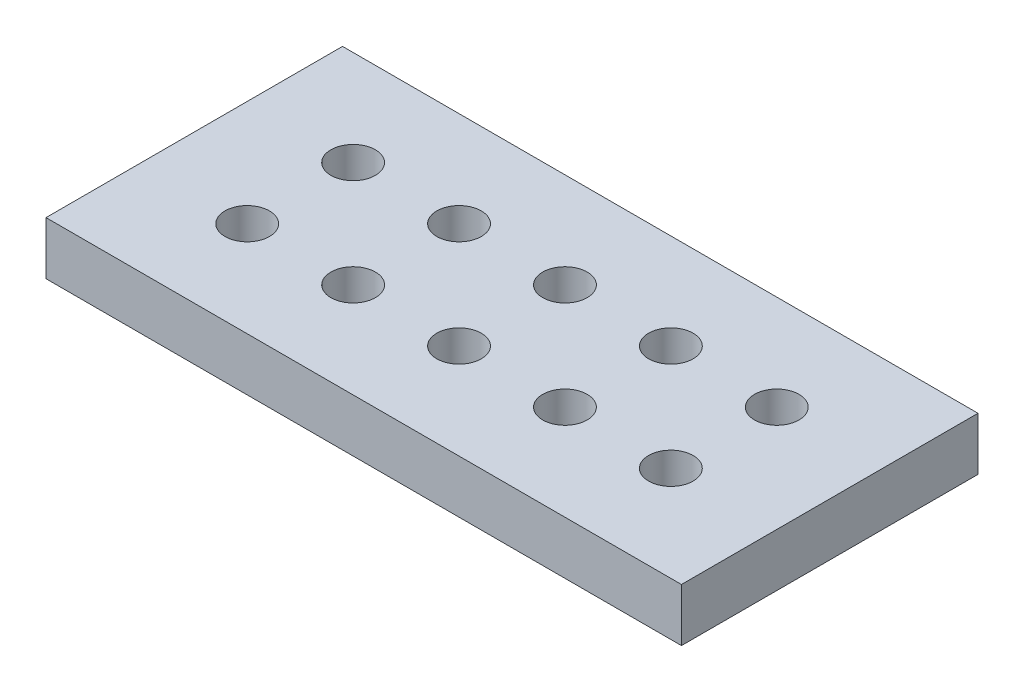
from build123d import *

# Parameters (mm, degrees)
SKETCH1_W           = 76.2
SKETCH1_H           = 35.56
SKETCH1_R           = 2.667
BOSS_EXTRUDE1_DEPTH = 3.175
SKETCH2_R           = 1.3462
CUT_EXTRUDE1_DEPTH  = 6.35


with BuildPart() as part:
    # Sketch1 → Boss-Extrude1 (new, symmetric)
    with BuildSketch(Plane(origin=(0, 0, 0), x_dir=(1, 0, 0), z_dir=(0, 1, 0))):
        Rectangle(SKETCH1_W, SKETCH1_H)
        with Locations(Location((-25.4, 6.35, 0), (0, 0, 270))):
            Circle(SKETCH1_R, mode=Mode.SUBTRACT)
        with Locations(Location((-12.7, 6.35, 0), (0, 0, 270))):
            Circle(SKETCH1_R, mode=Mode.SUBTRACT)
        with Locations(Location((0, 6.35, 0), (0, 0, 270))):
            Circle(SKETCH1_R, mode=Mode.SUBTRACT)
        with Locations(Location((12.7, 6.35, 0), (0, 0, 270))):
            Circle(SKETCH1_R, mode=Mode.SUBTRACT)
        with Locations(Location((25.4, 6.35, 0), (0, 0, 270))):
            Circle(SKETCH1_R, mode=Mode.SUBTRACT)
        with Locations(Location((-12.7, -6.35, 0), (0, 0, 270))):
            Circle(SKETCH1_R, mode=Mode.SUBTRACT)
        with Locations(Location((0, -6.35, 0), (0, 0, 270))):
            Circle(SKETCH1_R, mode=Mode.SUBTRACT)
        with Locations(Location((12.7, -6.35, 0), (0, 0, 270))):
            Circle(SKETCH1_R, mode=Mode.SUBTRACT)
        with Locations(Location((25.4, -6.35, 0), (0, 0, 270))):
            Circle(SKETCH1_R, mode=Mode.SUBTRACT)
        with Locations(Location((-25.4, -6.35, 0), (0, 0, 270))):
            Circle(SKETCH1_R, mode=Mode.SUBTRACT)
    extrude(amount=BOSS_EXTRUDE1_DEPTH, both=True)

    # Sketch2 → Cut-Extrude1 (cut)
    with BuildSketch(Plane.ZY.offset(38.1)):
        with Locations((-12.7, 0)):
            Circle(SKETCH2_R)
        with Locations((-6.35, 0)):
            Circle(SKETCH2_R)
        Circle(SKETCH2_R)
        with Locations((6.35, 0)):
            Circle(SKETCH2_R)
        with Locations((12.7, 0)):
            Circle(SKETCH2_R)
    extrude(amount=-CUT_EXTRUDE1_DEPTH, mode=Mode.SUBTRACT)


solid = part.part
